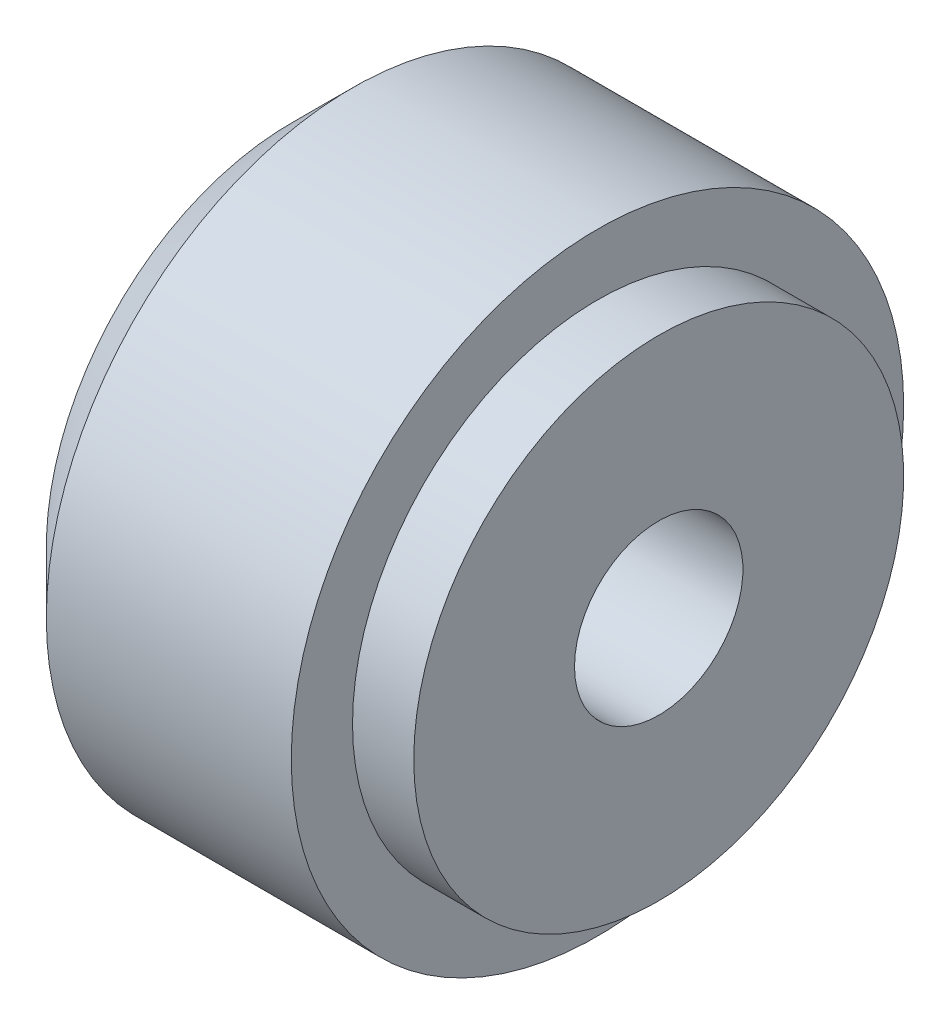
from build123d import *

# Parameters (mm, degrees)
FRONT_CHAMFERS_SIZE        = 2
MOUNTING_SCREW_D           = 5.5
MOUNTING_SCREW_DEPTH       = 12
MOUNTING_SCREW_CBORE_D     = 10
MOUNTING_SCREW_CBORE_DEPTH = 5.4
MOUNTING_SCREW_TIP         = 1.652366702


with BuildPart() as part:
    # Sketch1 → body (revolve)
    with BuildSketch(Plane.XY, mode=Mode.PRIVATE) as body_sk:
        Polygon((0, 0), (0, 8), (-2, 8), (-2, 10), (-12, 10), (-12, 0), align=None)
    revolve(body_sk.sketch.rotate(Axis((0, 0, 0), (1, 0, 0)), 90), axis=Axis((0, 0, 0), (1, 0, 0)))

    # front_chamfers
    front_chamfers_edges = [part.edges().sort_by_distance(p)[0] for p in [
        (-12, 0, -10),
    ]]
    chamfer(front_chamfers_edges, length=FRONT_CHAMFERS_SIZE)

    # mounting_screw
    with Locations(Plane.ZY.offset(12)):
        with Locations((0, 0)):
            CounterBoreHole(MOUNTING_SCREW_D / 2, MOUNTING_SCREW_CBORE_D / 2, MOUNTING_SCREW_CBORE_DEPTH, depth=MOUNTING_SCREW_DEPTH)
            with Locations((0, 0, -(MOUNTING_SCREW_DEPTH + MOUNTING_SCREW_TIP / 2))):  # 118° drill point
                Cone(0, MOUNTING_SCREW_D / 2, MOUNTING_SCREW_TIP, mode=Mode.SUBTRACT)


solid = part.part
